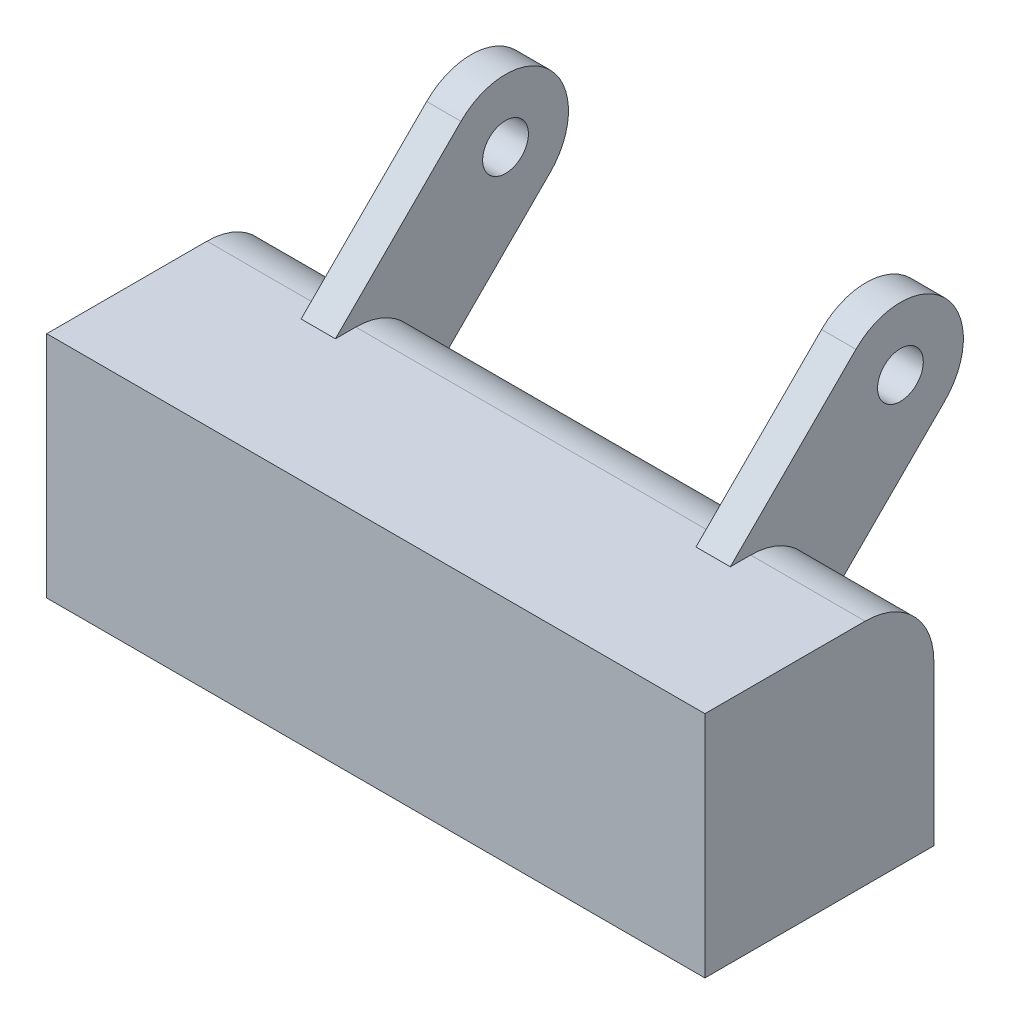
from build123d import *

# Parameters (mm, degrees)
EXTRUDE1_DEPTH = 28.75
EXTRUDE2_START = 18.75
SKETCH2_R      = 2
EXTRUDE2_DEPTH = 3
EXTRUDE3_START = -15.75
SKETCH_R       = 2
EXTRUDE3_DEPTH = 3


with BuildPart() as part:
    # Sketch1 → Extrude1 (new, symmetric)
    with BuildSketch(Plane(origin=(0, 0, 0), x_dir=(0, 0, -1), z_dir=(1, 0, 0))):
        with BuildLine():
            Line((-6, 0), (-20, 0))
            Line((-20, 0), (-20, -20))
            Line((-20, -20), (0, -20))
            Line((0, -20), (0, -6))
            ThreePointArc((0, -6), (-1.757359313, -1.757359313), (-6, 0))
        make_face()
    extrude(amount=EXTRUDE1_DEPTH, both=True)

    # Sketch2 → Extrude2 (add)
    with BuildSketch(Plane(origin=(0, 0, 0), x_dir=(0, 0, -1), z_dir=(1, 0, 0)).offset(EXTRUDE2_START)):
        with BuildLine():
            Line((-6.707106781, -14.485281374), (10.970562748, 3.192388155))
            ThreePointArc((10.970562748, 3.192388155), (10.970562748, 10.970562748), (3.192388155, 10.970562748))
            Line((3.192388155, 10.970562748), (-14.485281374, -6.707106781))
            Line((-14.485281374, -6.707106781), (-6.707106781, -14.485281374))
        make_face()
        with Locations((7.081475452, 7.081475452)):
            Circle(SKETCH2_R, mode=Mode.SUBTRACT)
    extrude(amount=-EXTRUDE2_DEPTH)

    # Sketch → Extrude3 (add)
    with BuildSketch(Plane(origin=(0, 0, 0), x_dir=(0, 0, -1), z_dir=(1, 0, 0)).offset(EXTRUDE3_START)):
        with BuildLine():
            Line((-6.707106781, -14.485281374), (10.970562748, 3.192388155))
            ThreePointArc((10.970562748, 3.192388155), (10.970562748, 10.970562748), (3.192388155, 10.970562748))
            Line((3.192388155, 10.970562748), (-14.485281374, -6.707106781))
            Line((-14.485281374, -6.707106781), (-6.707106781, -14.485281374))
        make_face()
        with Locations((7.081475452, 7.081475452)):
            Circle(SKETCH_R, mode=Mode.SUBTRACT)
    extrude(amount=-EXTRUDE3_DEPTH)


solid = part.part
